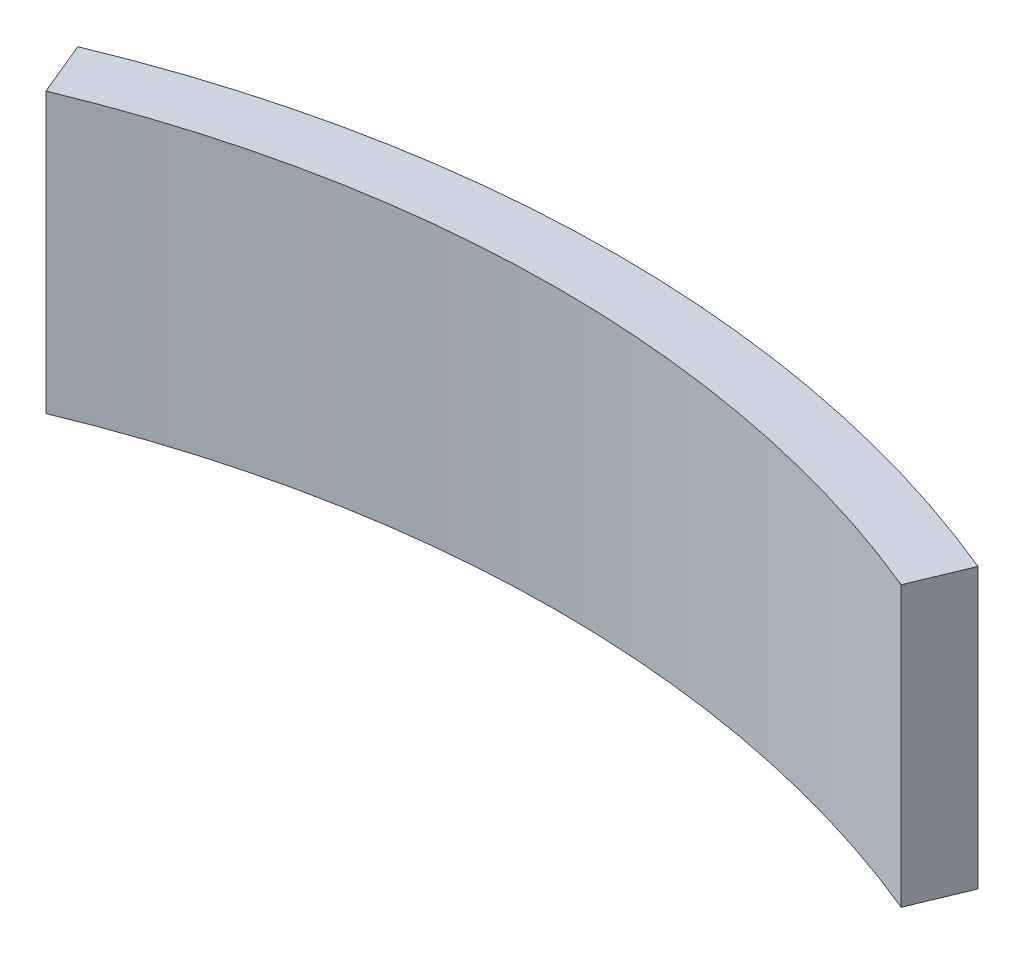
from build123d import *

# Parameters (mm, degrees)
BOSS_EXTRUDE1_DEPTH = 9.5


with BuildPart() as part:
    # Sketch1 → Boss-Extrude1 (new, symmetric)
    with BuildSketch(Plane(origin=(0, 0, 0), x_dir=(1, 0, 0), z_dir=(0, 1, 0))):
        with BuildLine():
            Line((-30.614674589, 73.910362601), (-29.08394086, 70.214844471))
            ThreePointArc((-29.08394086, 70.214844471), (0, 76), (29.08394086, 70.214844471))
            Line((29.08394086, 70.214844471), (30.614674589, 73.910362601))
            ThreePointArc((30.614674589, 73.910362601), (0, 80), (-30.614674589, 73.910362601))
        make_face()
    extrude(amount=BOSS_EXTRUDE1_DEPTH, both=True)


solid = part.part
